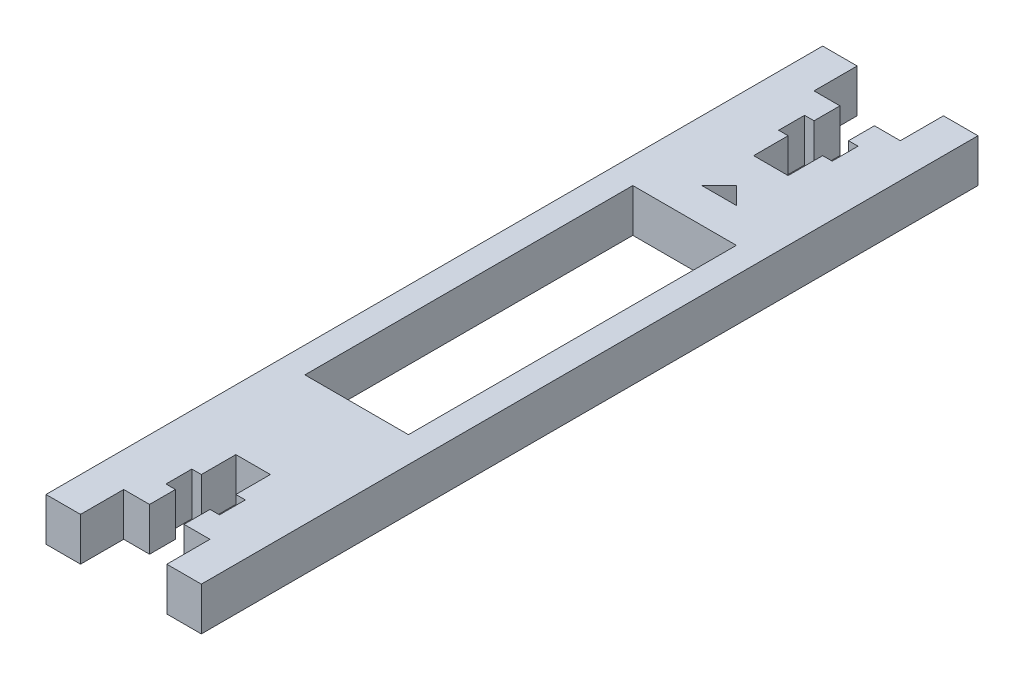
from build123d import *

# Parameters (mm, degrees)
SKETCH1_W           = 12
SKETCH1_H           = 38
BOSS_EXTRUDE4_DEPTH = 5


with BuildPart() as part:
    # Sketch1 → Boss-Extrude4 (new body)
    with BuildSketch(Plane(origin=(0, 0, 0), x_dir=(1, 0, 0), z_dir=(0, 1, 0))):
        Polygon((-8.645320197, 61.366995074), (-5.645320197, 61.366995074), (-5.645320197, 58.366995074), (-6.745320197, 58.366995074), (-6.745320197, 55.366995074), (-5.645320197, 55.366995074), (-5.645320197, 51.366995074), (-1.645320197, 51.366995074), (-1.645320197, 55.366995074), (-0.545320197, 55.366995074), (-0.545320197, 58.366995074), (-1.645320197, 58.366995074), (-1.645320197, 61.366995074), (1.354679803, 61.366995074), (1.354679803, 66.366995074), (5.354679803, 66.366995074), (5.354679803, 61.366995074), (5.354679803, 16.366995074), (5.354679803, -3.633004926), (5.354679803, -18.633004926), (5.354679803, -23.633004926), (1.354679803, -23.633004926), (1.354679803, -18.633004926), (-1.645320197, -18.633004926), (-1.645320197, -15.633004926), (-0.545320197, -15.633004926), (-0.545320197, -12.633004926), (-1.645320197, -12.633004926), (-1.645320197, -8.633004926), (-5.645320197, -8.633004926), (-5.645320197, -12.633004926), (-6.745320197, -12.633004926), (-6.745320197, -15.633004926), (-5.645320197, -15.633004926), (-5.645320197, -18.633004926), (-8.645320197, -18.633004926), (-8.645320197, -23.633004926), (-12.645320197, -23.633004926), (-12.645320197, -18.633004926), (-12.645320197, -3.633004926), (-12.645320197, 16.366995074), (-12.645320197, 61.366995074), (-12.645320197, 66.366995074), (-8.645320197, 66.366995074), align=None)
        with Locations((-3.645320197, 22.366995074)):
            Rectangle(SKETCH1_W, SKETCH1_H, mode=Mode.SUBTRACT)
        Polygon((-5.645320197, 45.366995074), (-1.645320197, 45.366995074), (-3.645320197, 47.366995074), align=None, mode=Mode.SUBTRACT)
    extrude(amount=BOSS_EXTRUDE4_DEPTH)


solid = part.part
